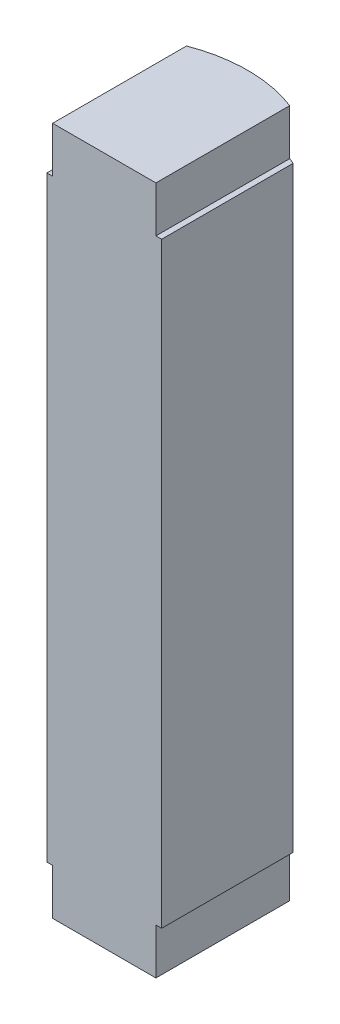
from build123d import *

# Parameters (mm, degrees)
BOSS_EXTRUDE1_DEPTH = 60
SKETCH3_W           = 0.5
SKETCH3_H           = 4
CUT_EXTRUDE1_DEPTH  = 20


with BuildPart() as part:
    # Sketch2 → Boss-Extrude1 (new body)
    with BuildSketch(Plane(origin=(0, 0, 0), x_dir=(1, 0, 0), z_dir=(0, 1, 0))):
        with BuildLine():
            Line((-5, 0), (5, 0))
            Line((5, 0), (5, 11.456439237))
            ThreePointArc((5, 11.456439237), (0, 12.5), (-5, 11.456439237))
            Line((-5, 11.456439237), (-5, 0))
        make_face()
    extrude(amount=BOSS_EXTRUDE1_DEPTH)

    # Sketch3 → Cut-Extrude1 (cut)
    with BuildSketch(Plane.XY):
        with Locations((-4.75, 2)):
            Rectangle(SKETCH3_W, SKETCH3_H)
        with Locations((4.75, 2)):
            Rectangle(SKETCH3_W, SKETCH3_H)
        with Locations((4.75, 58)):
            Rectangle(SKETCH3_W, SKETCH3_H)
        with Locations((-4.75, 58)):
            Rectangle(SKETCH3_W, SKETCH3_H)
    extrude(amount=-CUT_EXTRUDE1_DEPTH, mode=Mode.SUBTRACT)


solid = part.part
